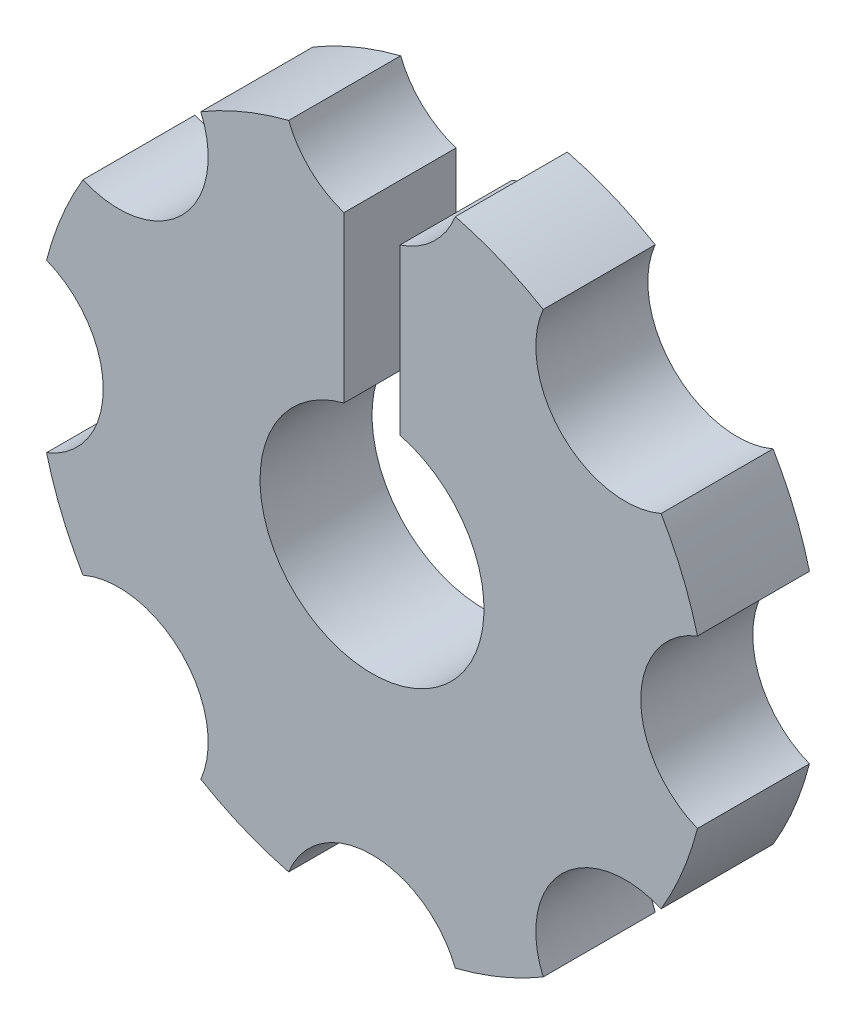
from build123d import *

# Parameters (mm, degrees)
CROQUIS1_R              = 9.525
CROQUIS1_R_2            = 3.175
SALIENTE_EXTRUIR1_DEPTH = 3.175
CROQUIS2_R              = 2.54
CORTAR_EXTRUIR1_DEPTH   = 3.175
CROQUIS3_W              = 1.5875
CROQUIS3_H              = 3.175
CORTAR_EXTRUIR2_DEPTH   = 14.430129201


with BuildPart() as part:
    # Croquis1 → Saliente-Extruir1 (new body)
    with BuildSketch(Plane.XY):
        Circle(CROQUIS1_R)
        Circle(CROQUIS1_R_2, mode=Mode.SUBTRACT)
    extrude(amount=SALIENTE_EXTRUIR1_DEPTH)

    # Croquis2 → Cortar-Extruir1 (cut)
    with BuildSketch(Plane.XY.offset(3.175)):
        with Locations((-10.16, 0)):
            Circle(CROQUIS2_R)
        with Locations((-7.184204897, 7.184204897)):
            Circle(CROQUIS2_R)
        with Locations((0, 10.16)):
            Circle(CROQUIS2_R)
        with Locations((7.184204897, 7.184204897)):
            Circle(CROQUIS2_R)
        with Locations((10.16, 0)):
            Circle(CROQUIS2_R)
        with Locations((7.184204897, -7.184204897)):
            Circle(CROQUIS2_R)
        with Locations((0, -10.16)):
            Circle(CROQUIS2_R)
        with Locations((-7.184204897, -7.184204897)):
            Circle(CROQUIS2_R)
    extrude(amount=-CORTAR_EXTRUIR1_DEPTH, mode=Mode.SUBTRACT)

    # Croquis3 → Cortar-Extruir2 (cut, through all)
    with BuildSketch(Plane(origin=(0, 0, 0), x_dir=(1, 0, 0), z_dir=(0, 1, 0))):
        with Locations((0, -1.5875)):
            Rectangle(CROQUIS3_W, CROQUIS3_H)
    extrude(amount=CORTAR_EXTRUIR2_DEPTH, mode=Mode.SUBTRACT)


solid = part.part
